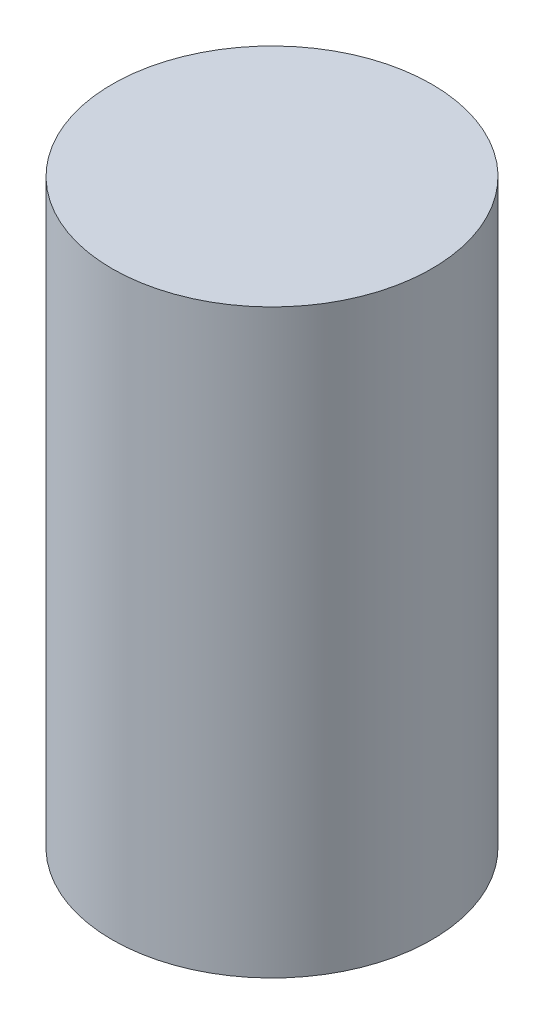
from build123d import *

# Parameters (mm, degrees)
SKETCH1_R           = 11
BOSS_EXTRUDE1_DEPTH = 40


with BuildPart() as part:
    # Sketch1 → Boss-Extrude1 (new body)
    with BuildSketch(Plane(origin=(0, 0, 0), x_dir=(1, 0, 0), z_dir=(0, 1, 0))):
        with Locations(Location((0, 0, 0), (0, 0, 270))):
            Circle(SKETCH1_R)
    extrude(amount=BOSS_EXTRUDE1_DEPTH)


solid = part.part
